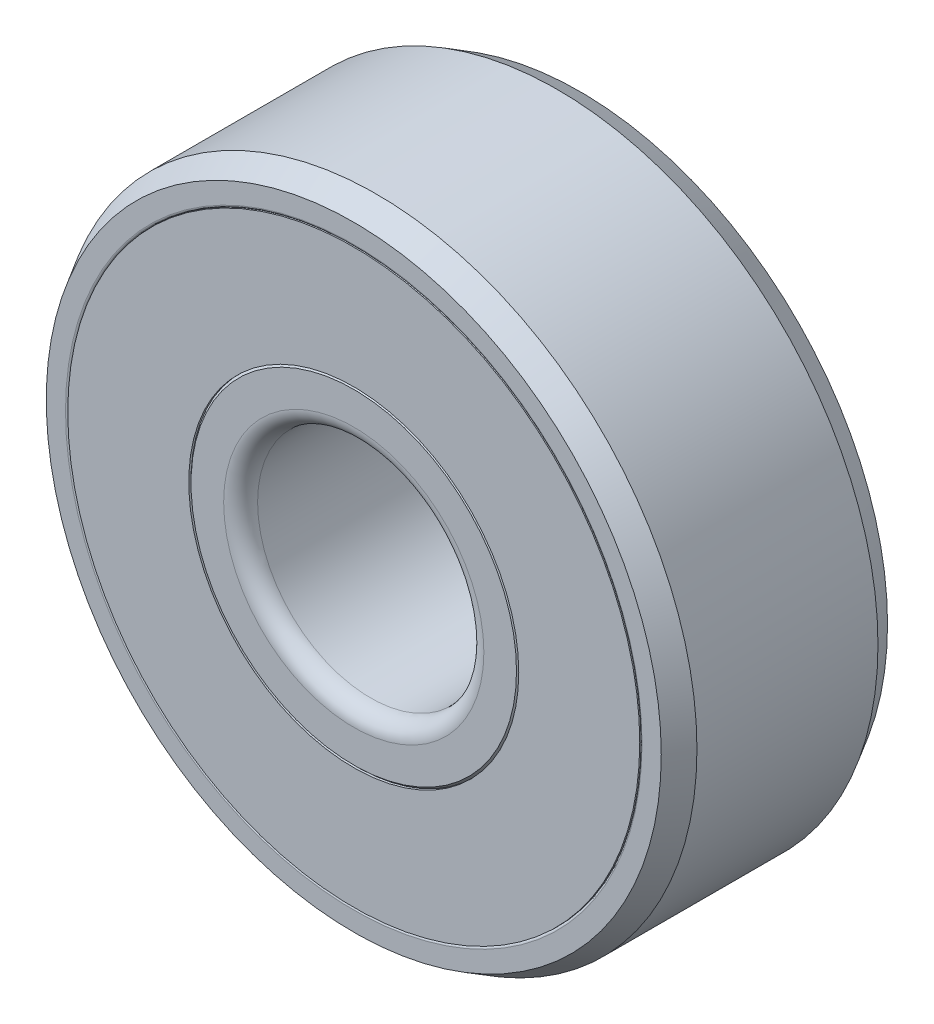
from build123d import *

# Parameters (mm, degrees)
SKETCH4_W         = 0.588541667
SKETCH4_H         = 3.208333333
CIRPATTERN1_COUNT = 7


with BuildPart() as part:
    # Sketch3 → Revolve1 (revolve)
    with BuildSketch(Plane(origin=(0, 0, 0), x_dir=(0, 0, -1), z_dir=(1, 0, 0)), mode=Mode.PRIVATE) as revolve1_sk:
        with BuildLine():
            Line((-2.4, -8.5), (2.4, -8.5))
            Line((2.4, -8.5), (3, -8.153589838))
            Line((3, -8.153589838), (3, -7.643333333))
            ThreePointArc((3, -7.643333333), (2.982426407, -7.600906926), (2.94, -7.583333333))
            Line((2.94, -7.583333333), (1.527777778, -7.583333333))
            ThreePointArc((1.527777778, -7.583333333), (0, -8.194444444), (-1.527777778, -7.583333333))
            Line((-1.527777778, -7.583333333), (-2.94, -7.583333333))
            ThreePointArc((-2.94, -7.583333333), (-2.982426407, -7.600906926), (-3, -7.643333333))
            Line((-3, -7.643333333), (-3, -8.153589838))
            Line((-3, -8.153589838), (-2.4, -8.5))
        make_face()
        with BuildLine():
            Line((-2.55, -3), (2.55, -3))
            ThreePointArc((2.55, -3), (2.868198052, -3.131801948), (3, -3.45))
            Line((3, -3.45), (3, -4.315))
            Line((3, -4.315), (2.94, -4.375))
            Line((2.94, -4.375), (1.527777778, -4.375))
            ThreePointArc((1.527777778, -4.375), (0, -3.763888889), (-1.527777778, -4.375))
            Line((-1.527777778, -4.375), (-2.94, -4.375))
            Line((-2.94, -4.375), (-3, -4.315))
            Line((-3, -4.315), (-3, -3.45))
            ThreePointArc((-3, -3.45), (-2.868198052, -3.131801948), (-2.55, -3))
        make_face()
    revolve(revolve1_sk.sketch.rotate(Axis((0, 0, 3), (0, 0, -1)), 270), axis=Axis((0, 0, 3), (0, 0, -1)))


with BuildPart() as body_2:
    # Sketch4 → Revolve2 (revolve)
    with BuildSketch(Plane(origin=(0, 0, 0), x_dir=(0, 0, -1), z_dir=(1, 0, 0)), mode=Mode.PRIVATE) as revolve2_sk:
        with Locations((-2.705729167, -5.979166667)):
            Rectangle(SKETCH4_W, SKETCH4_H)
    revolve(revolve2_sk.sketch.rotate(Axis((0, 0, 3), (0, 0, -1)), 270), axis=Axis((0, 0, 3), (0, 0, -1)))


with BuildPart() as body_3:
    # Sketch5 → Revolve3 (revolve)
    with BuildSketch(Plane(origin=(0, 0, 0), x_dir=(0, 0, -1), z_dir=(1, 0, 0))):
        with BuildLine():
            Line((0, -3.763888889), (0, -8.194444444))
            ThreePointArc((0, -8.194444444), (-2.215277778, -5.979166667), (0, -3.763888889))
        make_face()
    revolve(axis=Axis((0, 0, 0), (0, -1, 0)))


with BuildPart() as cirpattern1_1:
    # CirPattern1: pattern copy
    add(body_3.part.rotate(Axis((0, 0, 0), (0, 0, 1)), 1 * 360 / CIRPATTERN1_COUNT))


with BuildPart() as cirpattern1_2:
    # CirPattern1: pattern copy
    add(body_3.part.rotate(Axis((0, 0, 0), (0, 0, 1)), 2 * 360 / CIRPATTERN1_COUNT))


with BuildPart() as cirpattern1_3:
    # CirPattern1: pattern copy
    add(body_3.part.rotate(Axis((0, 0, 0), (0, 0, 1)), 3 * 360 / CIRPATTERN1_COUNT))


with BuildPart() as cirpattern1_4:
    # CirPattern1: pattern copy
    add(body_3.part.rotate(Axis((0, 0, 0), (0, 0, 1)), 4 * 360 / CIRPATTERN1_COUNT))


with BuildPart() as cirpattern1_5:
    # CirPattern1: pattern copy
    add(body_3.part.rotate(Axis((0, 0, 0), (0, 0, 1)), 5 * 360 / CIRPATTERN1_COUNT))


with BuildPart() as cirpattern1_6:
    # CirPattern1: pattern copy
    add(body_3.part.rotate(Axis((0, 0, 0), (0, 0, 1)), 6 * 360 / CIRPATTERN1_COUNT))


solid = Compound([part.part, body_2.part, body_3.part, cirpattern1_1.part, cirpattern1_2.part, cirpattern1_3.part, cirpattern1_4.part, cirpattern1_5.part, cirpattern1_6.part])
